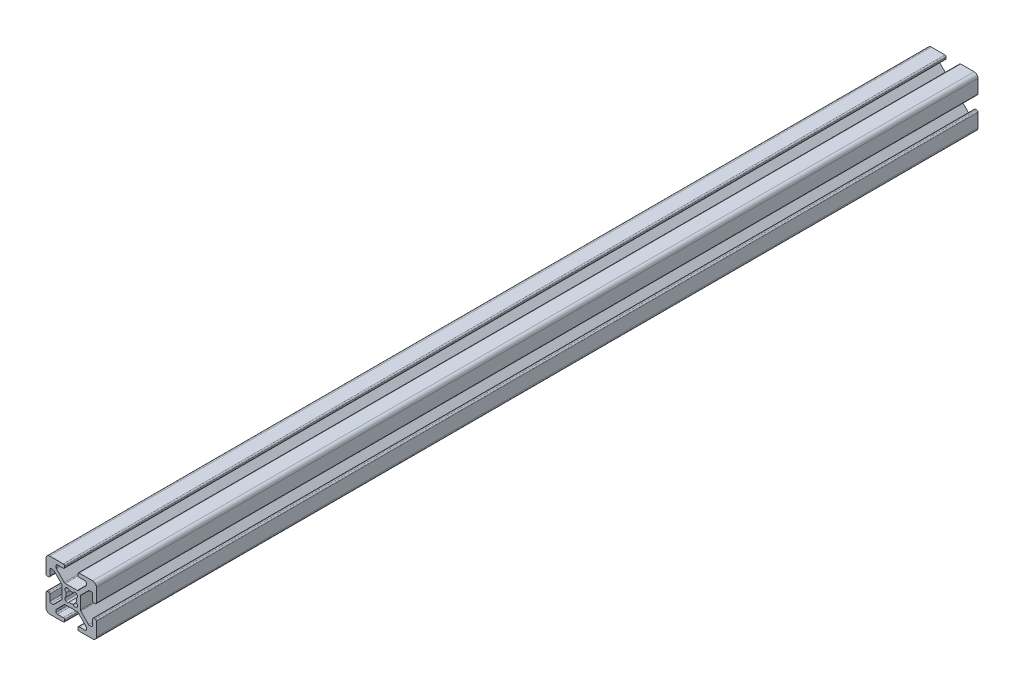
from build123d import *

# Parameters (mm, degrees)
EXTRUDE1_DEPTH = 350


with BuildPart() as part:
    # Sketch1 → Extrude1 (new body)
    with BuildSketch(Plane.XY):
        with BuildLine():
            Line((-5.032287798, -0.341059771), (-5.516287798, -0.341059771))
            ThreePointArc((-5.516287798, -0.341059771), (-5.875498042, -0.192270016), (-6.024287798, 0.166940229))
            Line((-6.024287798, 0.166940229), (-6.024287798, 2.515940229))
            ThreePointArc((-6.024287798, 2.515940229), (-6.173077553, 2.875150474), (-6.532287798, 3.023940229))
            Line((-6.532287798, 3.023940229), (-7.258207136, 3.023940229))
            ThreePointArc((-7.258207136, 3.023940229), (-7.45261032, 2.985271032), (-7.617417381, 2.875150474))
            Line((-7.617417381, 2.875150474), (-10.720498042, -0.227930187))
            ThreePointArc((-10.720498042, -0.227930187), (-10.8306186, -0.392737249), (-10.869287798, -0.587140432))
            Line((-10.869287798, -0.587140432), (-10.869287798, -5.354979109))
            ThreePointArc((-10.869287798, -5.354979109), (-10.8306186, -5.549382293), (-10.720498042, -5.714189354))
            Line((-10.720498042, -5.714189354), (-7.617417381, -8.817270016))
            ThreePointArc((-7.617417381, -8.817270016), (-7.45261032, -8.927390573), (-7.258207136, -8.966059771))
            Line((-7.258207136, -8.966059771), (-6.532287798, -8.966059771))
            ThreePointArc((-6.532287798, -8.966059771), (-6.173077553, -8.817270016), (-6.024287798, -8.458059771))
            Line((-6.024287798, -8.458059771), (-6.024287798, -6.109059771))
            ThreePointArc((-6.024287798, -6.109059771), (-5.875498042, -5.749849526), (-5.516287798, -5.601059771))
            Line((-5.516287798, -5.601059771), (-5.032287798, -5.601059771))
            ThreePointArc((-5.032287798, -5.601059771), (-4.673077553, -5.749849526), (-4.524287798, -6.109059771))
            Line((-4.524287798, -6.109059771), (-4.524287798, -11.471059771))
            ThreePointArc((-4.524287798, -11.471059771), (-4.963627626, -12.531719943), (-6.024287798, -12.971059771))
            Line((-6.024287798, -12.971059771), (-11.386287798, -12.971059771))
            ThreePointArc((-11.386287798, -12.971059771), (-11.745498042, -12.822270016), (-11.894287798, -12.463059771))
            Line((-11.894287798, -12.463059771), (-11.894287798, -11.979059771))
            ThreePointArc((-11.894287798, -11.979059771), (-11.745498042, -11.619849526), (-11.386287798, -11.471059771))
            Line((-11.386287798, -11.471059771), (-9.037287798, -11.471059771))
            ThreePointArc((-9.037287798, -11.471059771), (-8.678077553, -11.322270016), (-8.529287798, -10.963059771))
            Line((-8.529287798, -10.963059771), (-8.529287798, -10.237140432))
            ThreePointArc((-8.529287798, -10.237140432), (-8.567956995, -10.042737249), (-8.678077553, -9.877930187))
            Line((-8.678077553, -9.877930187), (-11.781158214, -6.774849526))
            ThreePointArc((-11.781158214, -6.774849526), (-11.945965275, -6.664728968), (-12.140368459, -6.626059771))
            Line((-12.140368459, -6.626059771), (-16.908207136, -6.626059771))
            ThreePointArc((-16.908207136, -6.626059771), (-17.10261032, -6.664728968), (-17.267417381, -6.774849526))
            Line((-17.267417381, -6.774849526), (-20.370498042, -9.877930187))
            ThreePointArc((-20.370498042, -9.877930187), (-20.4806186, -10.042737249), (-20.519287798, -10.237140432))
            Line((-20.519287798, -10.237140432), (-20.519287798, -10.963059771))
            ThreePointArc((-20.519287798, -10.963059771), (-20.370498042, -11.322270016), (-20.011287798, -11.471059771))
            Line((-20.011287798, -11.471059771), (-17.662287798, -11.471059771))
            ThreePointArc((-17.662287798, -11.471059771), (-17.303077553, -11.619849526), (-17.154287798, -11.979059771))
            Line((-17.154287798, -11.979059771), (-17.154287798, -12.463059771))
            ThreePointArc((-17.154287798, -12.463059771), (-17.303077553, -12.822270016), (-17.662287798, -12.971059771))
            Line((-17.662287798, -12.971059771), (-23.024287798, -12.971059771))
            ThreePointArc((-23.024287798, -12.971059771), (-24.084947969, -12.531719943), (-24.524287798, -11.471059771))
            Line((-24.524287798, -11.471059771), (-24.524287798, -6.109059771))
            ThreePointArc((-24.524287798, -6.109059771), (-24.375498042, -5.749849526), (-24.016287798, -5.601059771))
            Line((-24.016287798, -5.601059771), (-23.532287798, -5.601059771))
            ThreePointArc((-23.532287798, -5.601059771), (-23.173077553, -5.749849526), (-23.024287798, -6.109059771))
            Line((-23.024287798, -6.109059771), (-23.024287798, -8.458059771))
            ThreePointArc((-23.024287798, -8.458059771), (-22.875498042, -8.817270016), (-22.516287798, -8.966059771))
            Line((-22.516287798, -8.966059771), (-21.790368459, -8.966059771))
            ThreePointArc((-21.790368459, -8.966059771), (-21.595965275, -8.927390573), (-21.431158214, -8.817270016))
            Line((-21.431158214, -8.817270016), (-18.328077553, -5.714189354))
            ThreePointArc((-18.328077553, -5.714189354), (-18.217956995, -5.549382293), (-18.179287798, -5.354979109))
            Line((-18.179287798, -5.354979109), (-18.179287798, -0.587140432))
            ThreePointArc((-18.179287798, -0.587140432), (-18.217956995, -0.392737249), (-18.328077553, -0.227930187))
            Line((-18.328077553, -0.227930187), (-21.431158214, 2.875150474))
            ThreePointArc((-21.431158214, 2.875150474), (-21.595965275, 2.985271032), (-21.790368459, 3.023940229))
            Line((-21.790368459, 3.023940229), (-22.516287798, 3.023940229))
            ThreePointArc((-22.516287798, 3.023940229), (-22.875498042, 2.875150474), (-23.024287798, 2.515940229))
            Line((-23.024287798, 2.515940229), (-23.024287798, 0.166940229))
            ThreePointArc((-23.024287798, 0.166940229), (-23.173077553, -0.192270016), (-23.532287798, -0.341059771))
            Line((-23.532287798, -0.341059771), (-24.016287798, -0.341059771))
            ThreePointArc((-24.016287798, -0.341059771), (-24.375498042, -0.192270016), (-24.524287798, 0.166940229))
            Line((-24.524287798, 0.166940229), (-24.524287798, 5.528940229))
            ThreePointArc((-24.524287798, 5.528940229), (-24.084947969, 6.589600401), (-23.024287798, 7.028940229))
            Line((-23.024287798, 7.028940229), (-17.662287798, 7.028940229))
            ThreePointArc((-17.662287798, 7.028940229), (-17.303077553, 6.880150474), (-17.154287798, 6.520940229))
            Line((-17.154287798, 6.520940229), (-17.154287798, 6.036940229))
            ThreePointArc((-17.154287798, 6.036940229), (-17.303077553, 5.677729984), (-17.662287798, 5.528940229))
            Line((-17.662287798, 5.528940229), (-20.011287798, 5.528940229))
            ThreePointArc((-20.011287798, 5.528940229), (-20.370498042, 5.380150474), (-20.519287798, 5.020940229))
            Line((-20.519287798, 5.020940229), (-20.519287798, 4.295020891))
            ThreePointArc((-20.519287798, 4.295020891), (-20.4806186, 4.100617707), (-20.370498042, 3.935810646))
            Line((-20.370498042, 3.935810646), (-17.267417381, 0.832729984))
            ThreePointArc((-17.267417381, 0.832729984), (-17.10261032, 0.722609427), (-16.908207136, 0.683940229))
            Line((-16.908207136, 0.683940229), (-12.140368459, 0.683940229))
            ThreePointArc((-12.140368459, 0.683940229), (-11.945965275, 0.722609427), (-11.781158214, 0.832729984))
            Line((-11.781158214, 0.832729984), (-8.678077553, 3.935810646))
            ThreePointArc((-8.678077553, 3.935810646), (-8.567956995, 4.100617707), (-8.529287798, 4.295020891))
            Line((-8.529287798, 4.295020891), (-8.529287798, 5.020940229))
            ThreePointArc((-8.529287798, 5.020940229), (-8.678077553, 5.380150474), (-9.037287798, 5.528940229))
            Line((-9.037287798, 5.528940229), (-11.386287798, 5.528940229))
            ThreePointArc((-11.386287798, 5.528940229), (-11.745498042, 5.677729984), (-11.894287798, 6.036940229))
            Line((-11.894287798, 6.036940229), (-11.894287798, 6.520940229))
            ThreePointArc((-11.894287798, 6.520940229), (-11.745498042, 6.880150474), (-11.386287798, 7.028940229))
            Line((-11.386287798, 7.028940229), (-6.024287798, 7.028940229))
            ThreePointArc((-6.024287798, 7.028940229), (-4.963627626, 6.589600401), (-4.524287798, 5.528940229))
            Line((-4.524287798, 5.528940229), (-4.524287798, 0.166940229))
            ThreePointArc((-4.524287798, 0.166940229), (-4.673077553, -0.192270016), (-5.032287798, -0.341059771))
        make_face()
        with BuildLine():
            Line((-12.399386954, -5.275565737), (-12.219781831, -5.095960615))
            ThreePointArc((-12.219781831, -5.095960615), (-12.018349781, -4.327527582), (-12.589154291, -3.775036489))
            ThreePointArc((-12.589154291, -3.775036489), (-12.428787798, -2.971059771), (-12.589154291, -2.167083053))
            ThreePointArc((-12.589154291, -2.167083053), (-12.018349781, -1.61459196), (-12.219781831, -0.846158927))
            Line((-12.219781831, -0.846158927), (-12.399386954, -0.666553805))
            ThreePointArc((-12.399386954, -0.666553805), (-13.167819987, -0.465121754), (-13.72031108, -1.035926265))
            ThreePointArc((-13.72031108, -1.035926265), (-14.524287798, -0.875559771), (-15.328264516, -1.035926265))
            ThreePointArc((-15.328264516, -1.035926265), (-15.880755608, -0.465121754), (-16.649188641, -0.666553805))
            Line((-16.649188641, -0.666553805), (-16.828793764, -0.846158927))
            ThreePointArc((-16.828793764, -0.846158927), (-17.030225814, -1.61459196), (-16.459421304, -2.167083053))
            ThreePointArc((-16.459421304, -2.167083053), (-16.619787798, -2.971059771), (-16.459421304, -3.775036489))
            ThreePointArc((-16.459421304, -3.775036489), (-17.030225814, -4.327527582), (-16.828793764, -5.095960615))
            Line((-16.828793764, -5.095960615), (-16.649188641, -5.275565737))
            ThreePointArc((-16.649188641, -5.275565737), (-15.880755608, -5.476997788), (-15.328264516, -4.906193277))
            ThreePointArc((-15.328264516, -4.906193277), (-14.524287798, -5.066559771), (-13.72031108, -4.906193277))
            ThreePointArc((-13.72031108, -4.906193277), (-13.167819987, -5.476997788), (-12.399386954, -5.275565737))
        make_face(mode=Mode.SUBTRACT)
    extrude(amount=EXTRUDE1_DEPTH)


solid = part.part
